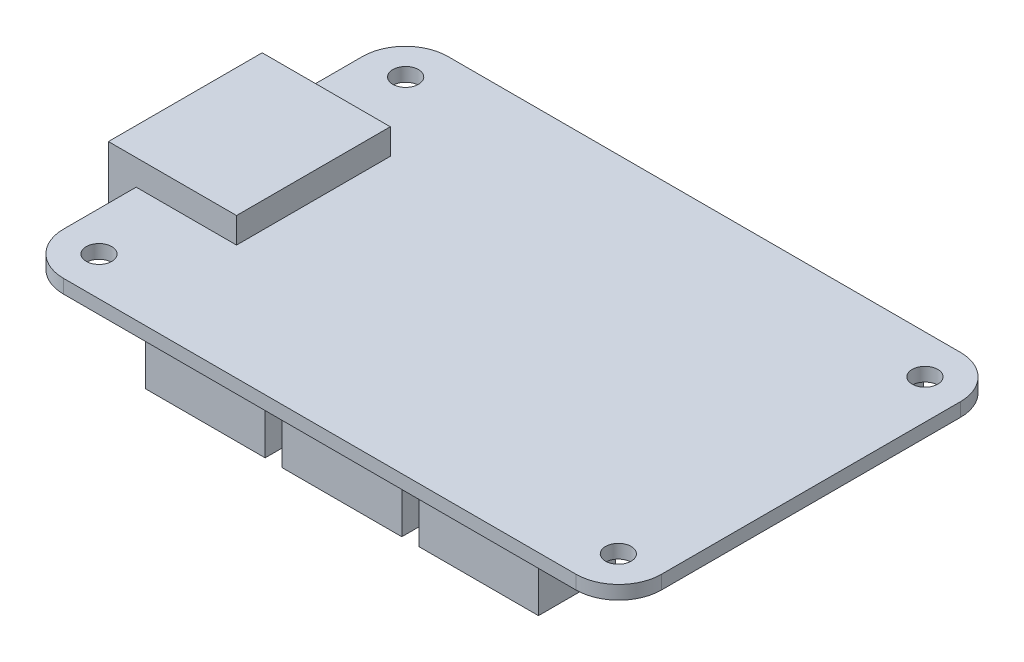
from build123d import *

# Parameters (mm, degrees)
SKETCH_1_R      = 2.5
EXTRUDE_1_DEPTH = 1.6
SKETCH_2_W      = 15
SKETCH_2_H      = 18
EXTRUDE_2_DEPTH = 10
SKETCH_3_W      = 10
SKETCH_3_H      = 6.85
SKETCH_3_W_2    = 14.15
SKETCH_3_H_2    = 8.85
SKETCH_3_W_3    = 14
SKETCH_3_H_3    = 9
EXTRUDE_3_DEPTH = 5
SKETCH_1_3_R    = 2.5
SKETCH_1_3_R_2  = 1.5
EXTRUDE_4_DEPTH = 1.6


with BuildPart() as part:
    # 草图1 → 凸台-拉伸1 (new body)
    with BuildSketch(Plane(origin=(0, 0, 0), x_dir=(1, 0, 0), z_dir=(0, 1, 0))):
        with BuildLine():
            Line((30, 22.5), (-30, 22.5))
            ThreePointArc((-30, 22.5), (-33.535533906, 21.035533906), (-35, 17.5))
            Line((-35, 17.5), (-35, -17.5))
            ThreePointArc((-35, -17.5), (-33.535533906, -21.035533906), (-30, -22.5))
            Line((-30, -22.5), (30, -22.5))
            ThreePointArc((30, -22.5), (33.535533906, -21.035533906), (35, -17.5))
            Line((35, -17.5), (35, 17.5))
            ThreePointArc((35, 17.5), (33.535533906, 21.035533906), (30, 22.5))
        make_face()
        with Locations((-30.4, -17.95)):
            Circle(SKETCH_1_R, mode=Mode.SUBTRACT)
        with Locations((30.4, -17.95)):
            Circle(SKETCH_1_R, mode=Mode.SUBTRACT)
        with Locations((-30.4, 17.95)):
            Circle(SKETCH_1_R, mode=Mode.SUBTRACT)
        with Locations((30.4, 17.95)):
            Circle(SKETCH_1_R, mode=Mode.SUBTRACT)
    extrude(amount=EXTRUDE_1_DEPTH)

    # 草图2 → 凸台-拉伸2 (add)
    with BuildSketch(Plane(origin=(0, 4.6, 0), x_dir=(1, 0, 0), z_dir=(0, 1, 0))):
        with Locations((-30.75023032, 0)):
            Rectangle(SKETCH_2_W, SKETCH_2_H)
    extrude(amount=-EXTRUDE_2_DEPTH)

    # 草图3 → 凸台-拉伸3 (add)
    with BuildSketch(Plane.XZ):
        with Locations((-21.9, -18.875)):
            Rectangle(SKETCH_3_W, SKETCH_3_H)
        with Locations((-10.4, -18.875)):
            Rectangle(SKETCH_3_W, SKETCH_3_H)
        with Locations((2.675, -17.875)):
            Rectangle(SKETCH_3_W_2, SKETCH_3_H_2)
        with Locations((18.825, -17.875)):
            Rectangle(SKETCH_3_W_2, SKETCH_3_H_2)
        with Locations((-13.6, 17.8)):
            Rectangle(SKETCH_3_W_3, SKETCH_3_H_3)
        with Locations((2.4, 17.8)):
            Rectangle(SKETCH_3_W_3, SKETCH_3_H_3)
        with Locations((18.4, 17.8)):
            Rectangle(SKETCH_3_W_3, SKETCH_3_H_3)
    extrude(amount=EXTRUDE_3_DEPTH)

    # 草图1<3> → 凸台-拉伸4 (add)
    # profile 1 of 4: a face of its own
    with BuildSketch(Plane(origin=(0, 0, 0), x_dir=(1, 0, 0), z_dir=(0, 1, 0))):
        with Locations((-30.4, -17.95)):
            Circle(SKETCH_1_3_R)
        with Locations((-30.4, -17.95)):
            Circle(SKETCH_1_3_R_2, mode=Mode.SUBTRACT)
    # profile 2 of 4: a face of its own
    with BuildSketch(Plane(origin=(0, 0, 0), x_dir=(1, 0, 0), z_dir=(0, 1, 0))):
        with Locations((-30.4, 17.95)):
            Circle(SKETCH_1_3_R)
        with Locations((-30.4, 17.95)):
            Circle(SKETCH_1_3_R_2, mode=Mode.SUBTRACT)
    # profile 3 of 4: a face of its own
    with BuildSketch(Plane(origin=(0, 0, 0), x_dir=(1, 0, 0), z_dir=(0, 1, 0))):
        with Locations((30.4, 17.95)):
            Circle(SKETCH_1_3_R)
        with Locations((30.4, 17.95)):
            Circle(SKETCH_1_3_R_2, mode=Mode.SUBTRACT)
    # profile 4 of 4: a face of its own
    with BuildSketch(Plane(origin=(0, 0, 0), x_dir=(1, 0, 0), z_dir=(0, 1, 0))):
        with Locations((30.4, -17.95)):
            Circle(SKETCH_1_3_R)
        with Locations((30.4, -17.95)):
            Circle(SKETCH_1_3_R_2, mode=Mode.SUBTRACT)
    extrude(amount=EXTRUDE_4_DEPTH)


solid = part.part
